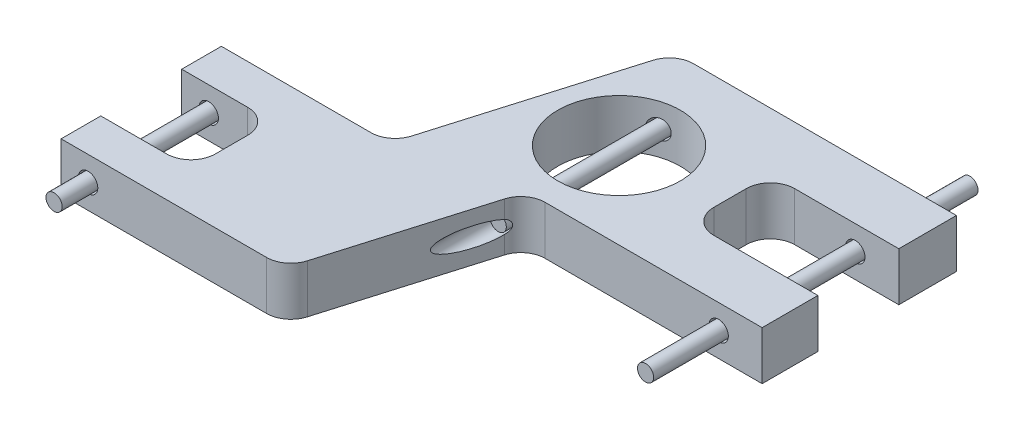
from build123d import *

# Parameters (mm, degrees)
SKETCH21_R         = 9.618966791
EXTRUDE1_DEPTH     = 3.81
SKETCH22_R         = 1.524
CUT_EXTRUDE1_DEPTH = 91.7575
EXTRUDE2_START     = -3.81
SKETCH24_R         = 1.27
EXTRUDE2_DEPTH     = 34.29
SKETCH24_3_R       = 1.27
EXTRUDE3_DEPTH     = 28.288
EXTRUDE4_START     = 5.08
SKETCH24_4_R       = 1.27
EXTRUDE4_DEPTH     = 50.894


with BuildPart() as part:
    # Sketch21 → Extrude1 (new, symmetric)
    with BuildSketch(Plane(origin=(0, 0, 0), x_dir=(1, 0, 0), z_dir=(0, 1, 0))):
        with BuildLine():
            Line((-68.34927062, -4.026580717), (-58.004863859, -4.026580717))
            ThreePointArc((-58.004863859, -4.026580717), (-55.310787023, -5.142503881), (-54.194863859, -7.836580717))
            Line((-54.194863859, -7.836580717), (-54.194863859, -12.916580717))
            ThreePointArc((-54.194863859, -12.916580717), (-55.310787023, -15.610657554), (-58.004863859, -16.726580717))
            Line((-58.004863859, -16.726580717), (-68.34927062, -16.726580717))
            Line((-68.34927062, -16.726580717), (-68.34927062, -22.949580717))
            Line((-68.34927062, -22.949580717), (-36.112461516, -22.949580717))
            ThreePointArc((-36.112461516, -22.949580717), (-33.831842297, -22.191608892), (-32.458648334, -20.219279394))
            Line((-32.458648334, -20.219279394), (-25.402661098, 3.658918981))
            ThreePointArc((-25.402661098, 3.658918981), (-24.029467135, 5.631248479), (-21.748847916, 6.389220304))
            Line((-21.748847916, 6.389220304), (12.303763798, 6.389220304))
            Line((12.303763798, 6.389220304), (12.303763798, 15.133953501))
            Line((12.303763798, 15.133953501), (-4.02424507, 15.133953501))
            ThreePointArc((-4.02424507, 15.133953501), (-6.718321906, 16.249876665), (-7.83424507, 18.943953501))
            Line((-7.83424507, 18.943953501), (-7.83424507, 24.023953501))
            ThreePointArc((-7.83424507, 24.023953501), (-6.718321906, 26.718030338), (-4.02424507, 27.833953501))
            Line((-4.02424507, 27.833953501), (12.303763798, 27.833953501))
            Line((12.303763798, 27.833953501), (12.303763798, 36.872358218))
            Line((12.303763798, 36.872358218), (-28.945825611, 36.872358218))
            ThreePointArc((-28.945825611, 36.872358218), (-31.22644483, 36.114386393), (-32.599638793, 34.142056894))
            Line((-32.599638793, 34.142056894), (-41.232745726, 4.926720606))
            ThreePointArc((-41.232745726, 4.926720606), (-42.605939689, 2.954391108), (-44.886558908, 2.196419283))
            Line((-44.886558908, 2.196419283), (-68.34927062, 2.196419283))
            Line((-68.34927062, 2.196419283), (-68.34927062, -4.026580717))
        make_face()
        with Locations(Location((-23.6637447, 19.907505249, 0), (0, 0, 90))):
            Circle(SKETCH21_R, mode=Mode.SUBTRACT)
    extrude(amount=EXTRUDE1_DEPTH, both=True)

    # Sketch22 → Cut-Extrude1 (cut, symmetric)
    with BuildSketch(Plane(origin=(0, 0, -36.872358218), x_dir=(-1, 0, 0), z_dir=(0, 0, -1))):
        with Locations((-5.47919097, 0)):
            Circle(SKETCH22_R)
        with Locations((64.11680903, 0)):
            Circle(SKETCH22_R)
        with Locations((26.528431516, 0)):
            Circle(SKETCH22_R)
    extrude(amount=CUT_EXTRUDE1_DEPTH, both=True, mode=Mode.SUBTRACT)


with BuildPart() as body_2:
    # Sketch24 → Extrude2 (new body)
    with BuildSketch(Plane.XY.offset(EXTRUDE2_START)):
        with Locations((-26.528431516, 0)):
            Circle(SKETCH24_R)
    extrude(amount=-EXTRUDE2_DEPTH)


with BuildPart() as body_3:
    # Sketch24<3> → Extrude3 (new body)
    with BuildSketch(Plane.XY):
        with Locations((-64.11680903, 0)):
            Circle(SKETCH24_3_R)
    extrude(amount=EXTRUDE3_DEPTH)


with BuildPart() as body_4:
    # Sketch24<4> → Extrude4 (new body)
    with BuildSketch(Plane.XY.offset(EXTRUDE4_START)):
        with Locations((5.47919097, 0)):
            Circle(SKETCH24_4_R)
    extrude(amount=-EXTRUDE4_DEPTH)


solid = Compound([part.part, body_2.part, body_3.part, body_4.part])
